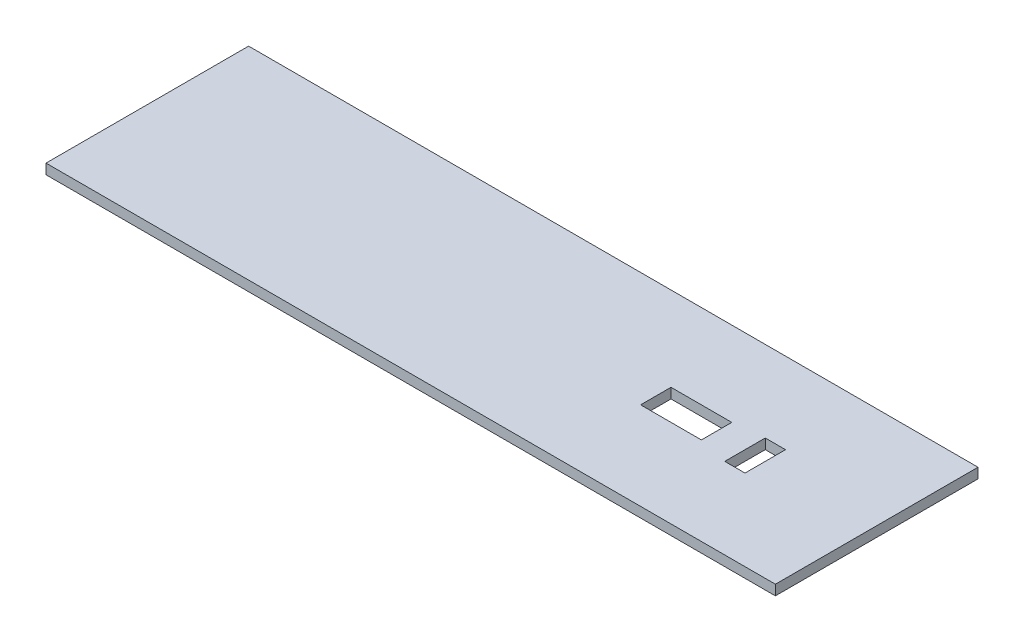
from build123d import *

# Parameters (mm, degrees)
CROQUIS1_W              = 720
CROQUIS1_H              = 200
SALIENTE_EXTRUIR1_DEPTH = 10
CROQUIS2_W              = 20
CROQUIS2_H              = 40
CORTAR_EXTRUIR1_DEPTH   = 10
CROQUIS3_W              = 60
CROQUIS3_H              = 30
CORTAR_EXTRUIR2_DEPTH   = 10


with BuildPart() as part:
    # Croquis1 → Saliente-Extruir1 (new body)
    with BuildSketch(Plane(origin=(0, 0, 0), x_dir=(1, 0, 0), z_dir=(0, 1, 0))):
        Rectangle(CROQUIS1_W, CROQUIS1_H)
    extrude(amount=SALIENTE_EXTRUIR1_DEPTH)

    # Croquis2 → Cortar-Extruir1 (cut)
    with BuildSketch(Plane(origin=(0, 0, 0), x_dir=(-1, 0, 0), z_dir=(0, -1, 0))):
        with Locations((-240, 0)):
            Rectangle(CROQUIS2_W, CROQUIS2_H)
    extrude(amount=-CORTAR_EXTRUIR1_DEPTH, mode=Mode.SUBTRACT)

    # Croquis3 → Cortar-Extruir2 (cut)
    with BuildSketch(Plane(origin=(0, 10, 0), x_dir=(1, 0, 0), z_dir=(0, 1, 0))):
        with Locations((170.145843921, 1.815492006)):
            Rectangle(CROQUIS3_W, CROQUIS3_H)
    extrude(amount=-CORTAR_EXTRUIR2_DEPTH, mode=Mode.SUBTRACT)


solid = part.part
